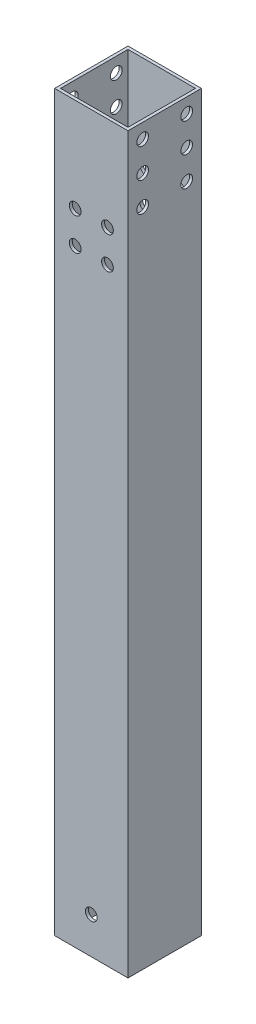
from build123d import *

# Parameters (mm, degrees)
SKETCH1_W           = 25
SKETCH1_H           = 25
SKETCH1_W_2         = 23
SKETCH1_H_2         = 23
BOSS_EXTRUDE1_DEPTH = 250
SKETCH3_R           = 2
CUT_EXTRUDE1_DEPTH  = 25
SKETCH4_R           = 2
CUT_EXTRUDE2_DEPTH  = 25
SKETCH5_R           = 2
CUT_EXTRUDE3_DEPTH  = 25


with BuildPart() as part:
    # Sketch1 → Boss-Extrude1 (new body)
    with BuildSketch(Plane(origin=(0, 0, 0), x_dir=(1, 0, 0), z_dir=(0, 1, 0))):
        Rectangle(SKETCH1_W, SKETCH1_H)
        Rectangle(SKETCH1_W_2, SKETCH1_H_2, mode=Mode.SUBTRACT)
    extrude(amount=BOSS_EXTRUDE1_DEPTH)

    # Sketch3 → Cut-Extrude1 (cut)
    with BuildSketch(Plane(origin=(12.5, 0, 0), x_dir=(0, 0, -1), z_dir=(1, 0, 0))):
        with Locations((7.5, 245)):
            Circle(SKETCH3_R)
        with Locations((7.5, 235)):
            Circle(SKETCH3_R)
        with Locations((-7.5, 245)):
            Circle(SKETCH3_R)
        with Locations((-7.5, 235)):
            Circle(SKETCH3_R)
        with Locations((7.5, 225)):
            Circle(SKETCH3_R)
        with Locations((-7.5, 225)):
            Circle(SKETCH3_R)
    extrude(amount=-CUT_EXTRUDE1_DEPTH, mode=Mode.SUBTRACT)

    # Sketch4 → Cut-Extrude2 (cut)
    with BuildSketch(Plane.XY.offset(12.5)):
        with Locations((5.5, 218)):
            Circle(SKETCH4_R)
        with Locations((5.5, 207)):
            Circle(SKETCH4_R)
    cut_extrude2 = extrude(amount=-CUT_EXTRUDE2_DEPTH, mode=Mode.SUBTRACT)

    # Sketch5 → Cut-Extrude3 (cut)
    with BuildSketch(Plane.XY.offset(12.5)):
        with Locations((0, 12.5)):
            Circle(SKETCH5_R)
    extrude(amount=-CUT_EXTRUDE3_DEPTH, mode=Mode.SUBTRACT)

    # Mirror1: Cut-Extrude2 across plane
    add(cut_extrude2.mirror(Plane(origin=(0, 0, 0), x_dir=(0, 0, 1), z_dir=(1, 0, 0))), mode=Mode.SUBTRACT)


solid = part.part
